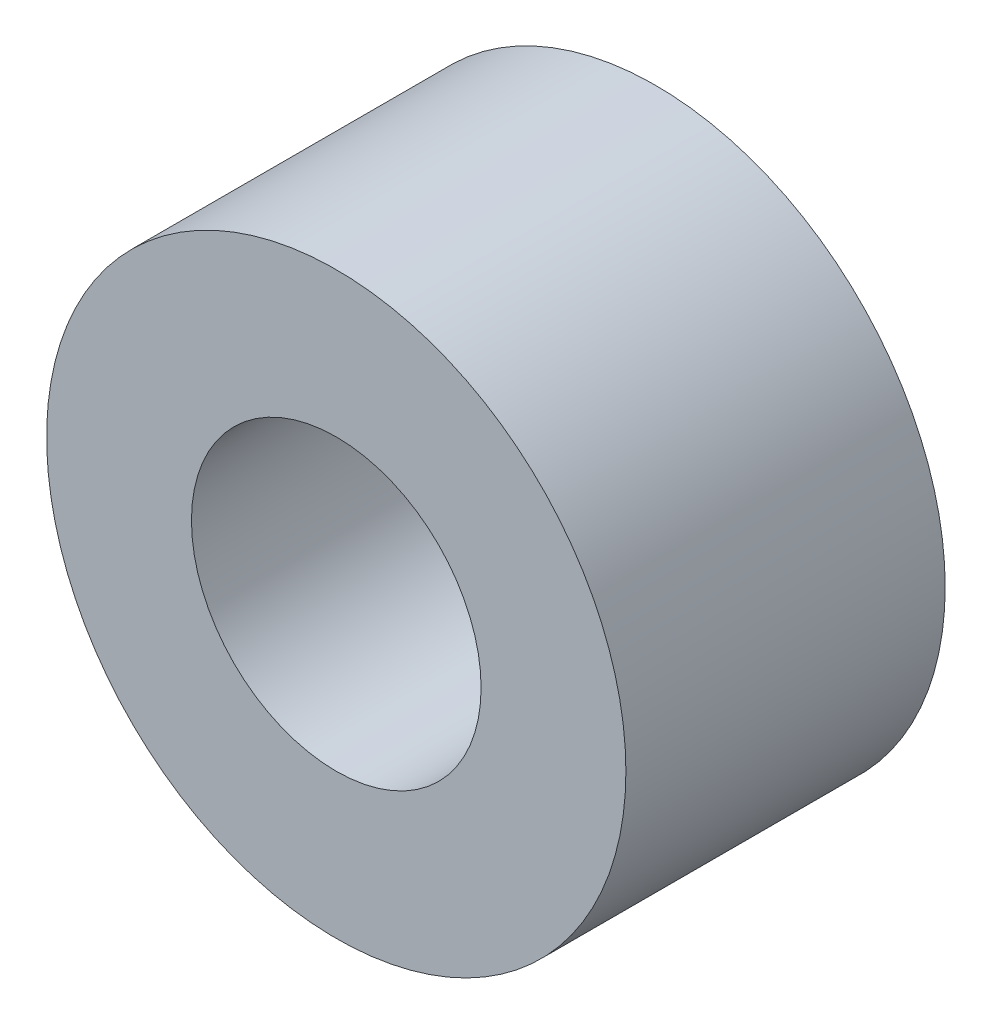
from build123d import *

# Parameters (mm, degrees)
SKETCH1_R           = 6.35
SKETCH1_R_2         = 3.175
BOSS_EXTRUDE1_DEPTH = 7


with BuildPart() as part:
    # Sketch1 → Boss-Extrude1 (new body)
    with BuildSketch(Plane.XY):
        Circle(SKETCH1_R)
        Circle(SKETCH1_R_2, mode=Mode.SUBTRACT)
    extrude(amount=BOSS_EXTRUDE1_DEPTH)


solid = part.part
